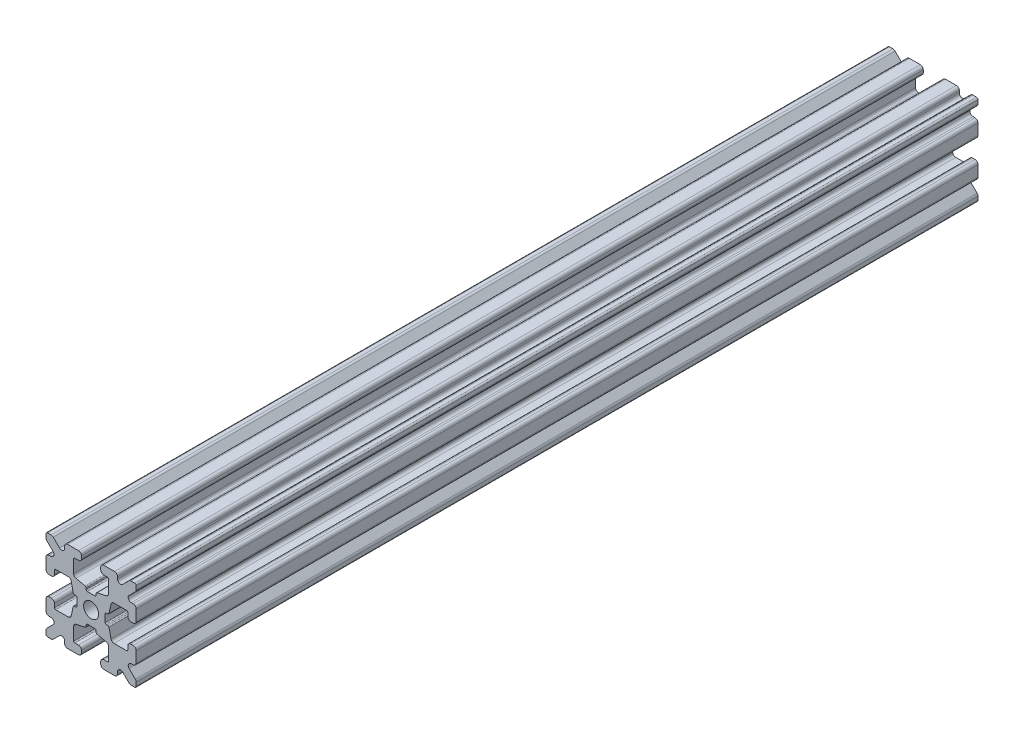
from build123d import *

# Parameters (mm, degrees)
SKETCH1_W           = 15
SKETCH1_H           = 15
SKETCH1_R           = 1.25
BOSS_EXTRUDE1_DEPTH = 70
FILLET1_R           = 0.25
CUT_EXTRUDE1_DEPTH  = 141.401210821
CUT_EXTRUDE3_DEPTH  = 141.401210821
FILLET3_R           = 0.5
FILLET4_R           = 0.5
FILLET5_R           = 3
FILLET6_R           = 0.2
CUT_EXTRUDE4_DEPTH  = 141.401210821
FILLET8_R           = 0.5
SKETCH6_W           = 5.1529354
SKETCH6_H           = 1.651
SKETCH6_W_2         = 1.651
SKETCH6_H_2         = 5.1529354
CUT_EXTRUDE5_DEPTH  = 141.401210821
FILLET10_R          = 0.2


with BuildPart() as part:
    # Sketch1 → Boss-Extrude1 (new, symmetric)
    with BuildSketch(Plane.XY):
        Rectangle(SKETCH1_W, SKETCH1_H)
        Circle(SKETCH1_R, mode=Mode.SUBTRACT)
    extrude(amount=BOSS_EXTRUDE1_DEPTH, both=True)

    # Fillet1
    fillet1_edges = [part.edges().sort_by_distance(p)[0] for p in [
        (7.5, -7.5, 0),
        (-7.5, -7.5, 0),
        (-7.5, 7.5, 0),
        (7.5, 7.5, 0),
    ]]
    fillet(fillet1_edges, radius=FILLET1_R)

    # Sketch2 → Cut-Extrude1 (cut, through all)
    with BuildSketch(Plane.XY.offset(70)):
        Polygon((-7.5, 1.6), (-6.1, 1.6), (-6.1, 2.9), (-3.4, 2.9), (-3.4, -2.9), (-6.1, -2.9), (-6.1, -1.6), (-7.5, -1.6), align=None)
        Polygon((2.9, 6.1), (1.6, 6.1), (1.6, 7.5), (-1.6, 7.5), (-1.6, 6.1), (-2.9, 6.1), (-2.9, 3.4), (2.9, 3.4), align=None)
        Polygon((-1.6, -7.5), (-1.6, -6.1), (-2.9, -6.1), (-2.9, -3.4), (2.9, -3.4), (2.9, -6.1), (1.6, -6.1), (1.6, -7.5), align=None)
        Polygon((6.1, -2.9), (6.1, -1.6), (7.5, -1.6), (7.5, 1.6), (6.1, 1.6), (6.1, 2.9), (3.4, 2.9), (3.4, -2.9), align=None)
    extrude(amount=-CUT_EXTRUDE1_DEPTH, mode=Mode.SUBTRACT)

    # Sketch4 → Cut-Extrude3 (cut, through all)
    with BuildSketch(Plane.XY.offset(70)):
        Polygon((-3.4, 2.9), (-2.75, 0), (-3.4, -2.9), align=None)
        Polygon((-2.9, 3.4), (0, 2.75), (2.9, 3.4), align=None)
        Polygon((3.4, 2.9), (2.75, 0), (3.4, -2.9), align=None)
        Polygon((-2.9, -3.4), (0, -2.75), (2.9, -3.4), align=None)
    extrude(amount=-CUT_EXTRUDE3_DEPTH, mode=Mode.SUBTRACT)

    # Fillet3
    fillet3_edges = [part.edges().sort_by_distance(p)[0] for p in [
        (1.6, -7.5, 0),
        (-1.6, -7.5, 0),
        (-1.6, -6.1, 0),
        (1.6, -6.1, 0),
        (6.1, 1.6, 0),
        (7.5, 1.6, 0),
        (7.5, -1.6, 0),
        (6.1, -1.6, 0),
        (-7.5, -1.6, 0),
        (-7.5, 1.6, 0),
        (-6.1, 1.6, 0),
        (-6.1, -1.6, 0),
        (-1.6, 6.1, 0),
        (-1.6, 7.5, 0),
        (1.6, 7.5, 0),
        (1.6, 6.1, 0),
    ]]
    fillet(fillet3_edges, radius=FILLET3_R)

    # Fillet4
    fillet4_edges = [part.edges().sort_by_distance(p)[0] for p in [
        (-2.9, -3.4, 0),
        (2.9, -3.4, 0),
        (3.4, -2.9, 0),
        (3.4, 2.9, 0),
        (-3.4, 2.9, 0),
        (-3.4, -2.9, 0),
        (2.9, 3.4, 0),
        (-2.9, 3.4, 0),
    ]]
    fillet(fillet4_edges, radius=FILLET4_R)

    # Fillet5
    fillet5_edges = [part.edges().sort_by_distance(p)[0] for p in [
        (-2.75, 0, 0),
        (0, 2.75, 0),
        (2.75, 0, 0),
        (0, -2.75, 0),
    ]]
    fillet(fillet5_edges, radius=FILLET5_R)

    # Fillet6
    fillet6_edges = [part.edges().sort_by_distance(p)[0] for p in [
        (-2.9, -6.1, 0),
        (2.9, -6.1, 0),
        (6.1, -2.9, 0),
        (6.1, 2.9, 0),
        (-6.1, 2.9, 0),
        (-6.1, -2.9, 0),
        (2.9, 6.1, 0),
        (-2.9, 6.1, 0),
    ]]
    fillet(fillet6_edges, radius=FILLET6_R)

    # Sketch5 → Cut-Extrude4 (cut, through all)
    with BuildSketch(Plane.XY.offset(70)):
        Polygon((-7.5, 6.439339828), (-5.460660172, 4.4), (-7.5, 4.4), align=None)
        Polygon((-6.439339828, 7.5), (-4.4, 5.460660172), (-4.4, 7.5), align=None)
        Polygon((4.4, 7.5), (6.439339828, 7.5), (4.4, 5.460660172), align=None)
        Polygon((7.5, 6.439339828), (7.5, 4.4), (5.460660172, 4.4), align=None)
        Polygon((7.5, -6.439339828), (5.460660172, -4.4), (7.5, -4.4), align=None)
        Polygon((6.439339828, -7.5), (4.4, -5.460660172), (4.4, -7.5), align=None)
        Polygon((-4.4, -7.5), (-6.439339828, -7.5), (-4.4, -5.460660172), align=None)
        Polygon((-7.5, -6.439339828), (-7.5, -4.4), (-5.460660172, -4.4), align=None)
    extrude(amount=-CUT_EXTRUDE4_DEPTH, mode=Mode.SUBTRACT)

    # Fillet8
    fillet8_edges = [part.edges().sort_by_distance(p)[0] for p in [
        (-7.5, 4.4, 0),
        (-7.5, 6.439339828, 0),
        (-5.460660172, 4.4, 0),
        (7.5, -4.4, 0),
        (7.5, -6.439339828, 0),
        (5.460660172, -4.4, 0),
        (5.460660172, 4.4, 0),
        (7.5, 6.439339828, 0),
        (7.5, 4.4, 0),
        (-4.4, 7.5, 0),
        (-4.4, 5.460660172, 0),
        (-6.439339828, 7.5, 0),
        (-5.460660172, -4.4, 0),
        (-7.5, -6.439339828, 0),
        (-7.5, -4.4, 0),
        (4.4, 5.460660172, 0),
        (4.4, 7.5, 0),
        (6.439339828, 7.5, 0),
        (6.439339828, -7.5, 0),
        (4.4, -7.5, 0),
        (4.4, -5.460660172, 0),
        (-6.439339828, -7.5, 0),
        (-4.4, -5.460660172, 0),
        (-4.4, -7.5, 0),
    ]]
    fillet(fillet8_edges, radius=FILLET8_R)

    # Sketch6 → Cut-Extrude5 (cut, through all)
    with BuildSketch(Plane.XY.offset(70)):
        with Locations((4.9235323, 0)):
            Rectangle(SKETCH6_W, SKETCH6_H)
        with Locations((0, -4.9235323)):
            Rectangle(SKETCH6_W_2, SKETCH6_H_2)
        with Locations((-4.9235323, 0)):
            Rectangle(SKETCH6_W, SKETCH6_H)
        with Locations((0, 4.9235323)):
            Rectangle(SKETCH6_W_2, SKETCH6_H_2)
    extrude(amount=-CUT_EXTRUDE5_DEPTH, mode=Mode.SUBTRACT)

    # Fillet10
    fillet10_edges = [part.edges().sort_by_distance(p)[0] for p in [
        (0.8255, -2.935025862, 0),
        (-0.8255, -2.935025862, 0),
        (0.8255, -2.3470646, 0),
        (-0.8255, -2.3470646, 0),
        (2.935025862, 0.8255, 0),
        (2.935025862, -0.8255, 0),
        (2.3470646, 0.8255, 0),
        (2.3470646, -0.8255, 0),
        (-2.935025862, -0.8255, 0),
        (-2.935025862, 0.8255, 0),
        (-2.3470646, -0.8255, 0),
        (-2.3470646, 0.8255, 0),
        (-0.8255, 2.935025862, 0),
        (0.8255, 2.935025862, 0),
        (-0.8255, 2.3470646, 0),
        (0.8255, 2.3470646, 0),
    ]]
    fillet(fillet10_edges, radius=FILLET10_R)


solid = part.part
